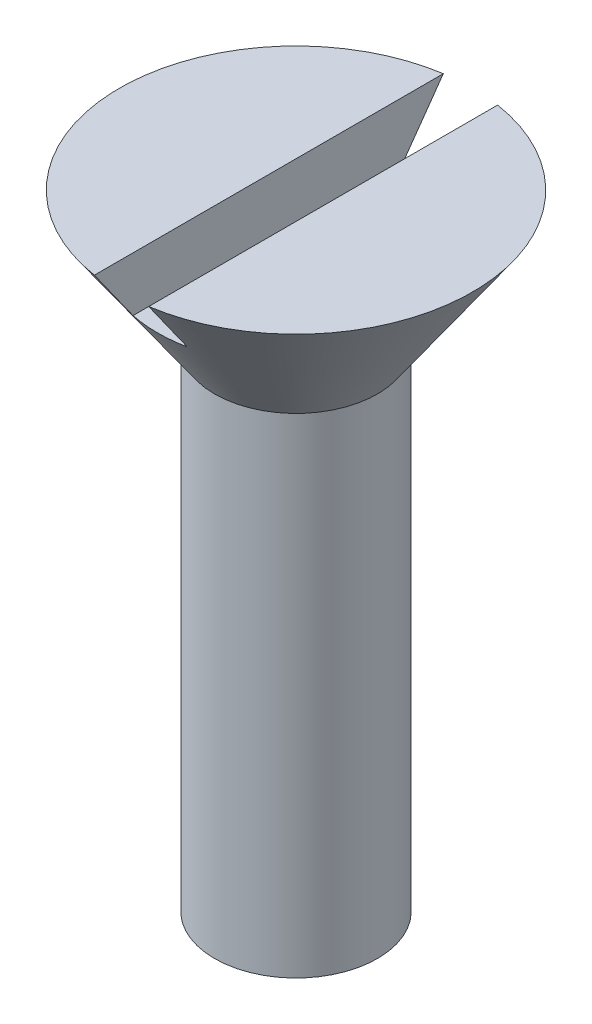
from build123d import *

# Parameters (mm, degrees)
SKETCH2_W          = 2
SKETCH2_H          = 4
CUT_EXTRUDE1_DEPTH = 15


with BuildPart() as part:
    # Sketch1 → Revolve1 (revolve)
    with BuildSketch(Plane.XY, mode=Mode.PRIVATE) as revolve1_sk:
        Polygon((0, 0), (6.5, 0), (3, -5), (3, -23), (0, -24.732050808), align=None)
    revolve(revolve1_sk.sketch.rotate(Axis((0, 0, 0), (0, -1, 0)), 90), axis=Axis((0, 0, 0), (0, -1, 0)))

    # Sketch2 → Cut-Extrude1 (cut, symmetric)
    with BuildSketch(Plane.XY):
        Rectangle(SKETCH2_W, SKETCH2_H)
    extrude(amount=CUT_EXTRUDE1_DEPTH, both=True, mode=Mode.SUBTRACT)


solid = part.part
